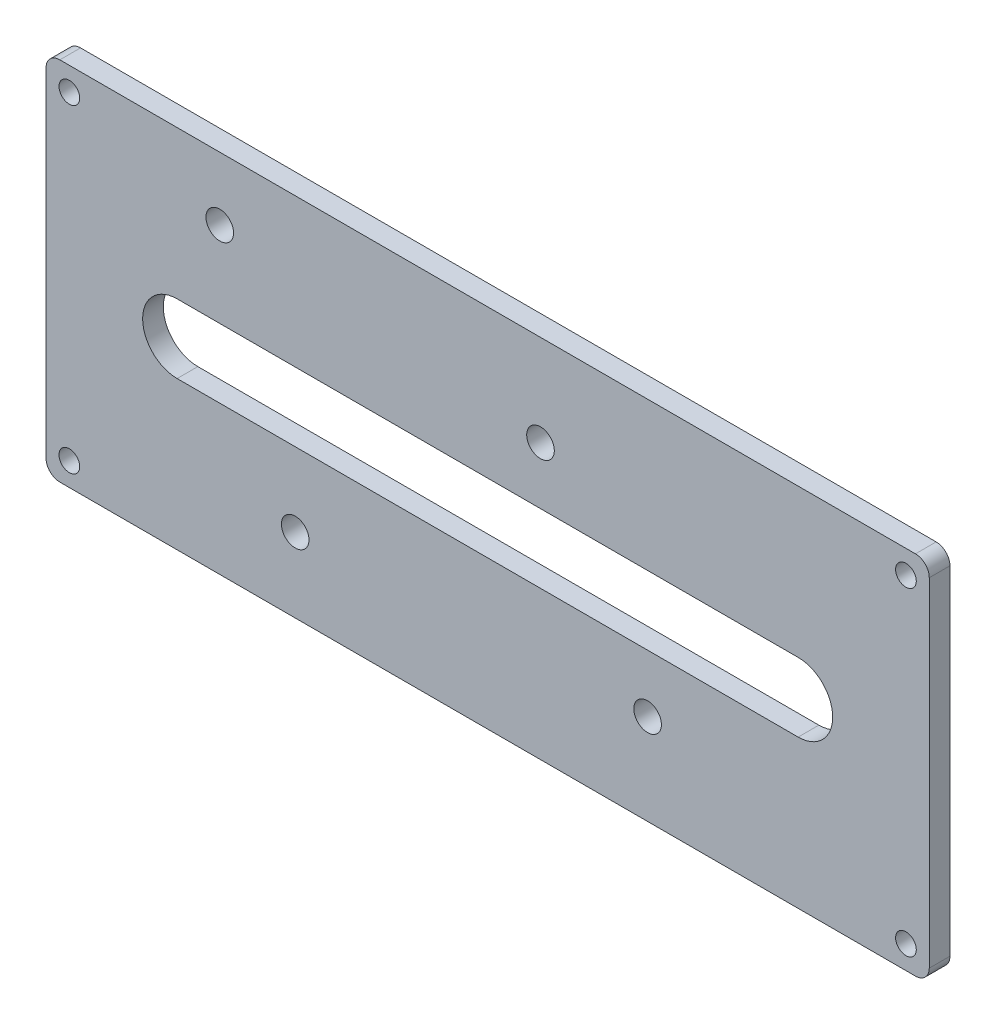
from build123d import *

# Parameters (mm, degrees)
ESQUISSE1_W             = 128
ESQUISSE1_H             = 53
BOSS_EXTRU_1_DEPTH      = 3
ESQUISSE2_R             = 2
ENL_V_MAT_EXTRU_1_DEPTH = 3
ENL_V_MAT_EXTRU_2_DEPTH = 3
ESQUISSE5_R             = 1.5
ENL_V_MAT_EXTRU_3_DEPTH = 3
CONG_1_R                = 2


with BuildPart() as part:
    # Esquisse1 → Boss.-Extru.1 (new body)
    with BuildSketch(Plane.XY):
        Rectangle(ESQUISSE1_W, ESQUISSE1_H)
    extrude(amount=BOSS_EXTRU_1_DEPTH)

    # Esquisse2 → Enlèv. mat.-Extru.1 (cut)
    with BuildSketch(Plane.XY.offset(3)):
        with Locations((-38.82, 17.35)):
            Circle(ESQUISSE2_R)
        with Locations((7.66, 13.27)):
            Circle(ESQUISSE2_R)
        with Locations((-27.89, -15.71)):
            Circle(ESQUISSE2_R)
        with Locations((23.18, -13.35)):
            Circle(ESQUISSE2_R)
    extrude(amount=-ENL_V_MAT_EXTRU_1_DEPTH, mode=Mode.SUBTRACT)

    # Esquisse3 → Enlèv. mat.-Extru.2 (cut)
    with BuildSketch(Plane.XY.offset(3)):
        with BuildLine():
            Line((-45.000000383, 5), (45.000000383, 5))
            ThreePointArc((45.000000383, 5), (50.000000383, 0), (45.000000383, -5))
            Line((45.000000383, -5), (-44.999999617, -5))
            ThreePointArc((-44.999999617, -5), (-49.999999617, -3.83e-07), (-45.000000383, 5))
        make_face()
    extrude(amount=-ENL_V_MAT_EXTRU_2_DEPTH, mode=Mode.SUBTRACT)

    # Esquisse5 → Enlèv. mat.-Extru.3 (cut)
    with BuildSketch(Plane.XY.offset(3)):
        with Locations((-60.62, 23.12)):
            Circle(ESQUISSE5_R)
        with Locations((60.62, 23.12)):
            Circle(ESQUISSE5_R)
        with Locations((-60.62, -23.12)):
            Circle(ESQUISSE5_R)
        with Locations((60.62, -23.12)):
            Circle(ESQUISSE5_R)
    extrude(amount=-ENL_V_MAT_EXTRU_3_DEPTH, mode=Mode.SUBTRACT)

    # Congé1
    cong_1_edges = [part.edges().sort_by_distance(p)[0] for p in [
        (-64, 26.5, 1.5),
        (64, 26.5, 1.5),
        (64, -26.5, 1.5),
        (-64, -26.5, 1.5),
    ]]
    fillet(cong_1_edges, radius=CONG_1_R)


solid = part.part
